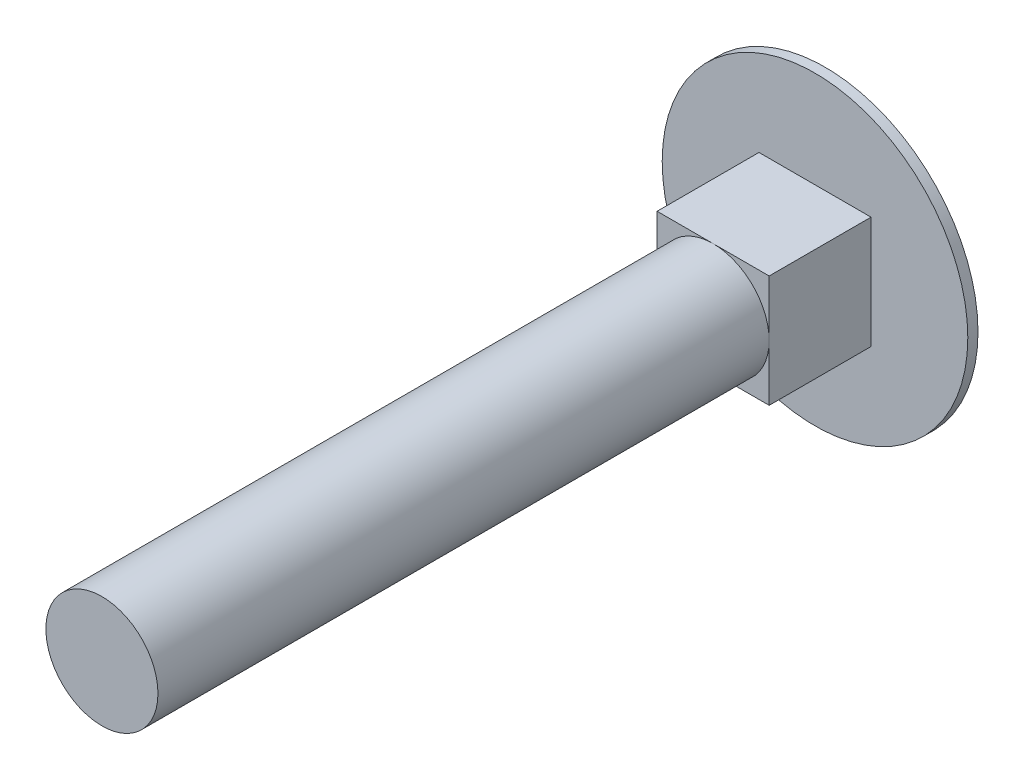
from build123d import *

# Parameters (mm, degrees)
ESQUISSE1_R        = 2.75
BOSS_EXTRU_1_DEPTH = 30
ESQUISSE2_W        = 5.5
ESQUISSE2_H        = 5.5
BOSS_EXTRU_2_DEPTH = 5
ESQUISSE3_R        = 7.5
BOSS_EXTRU_3_DEPTH = 0.5
D_ME1_FACE_RADIUS  = 7.5
D_ME1_HEIGHT       = 2.5


with BuildPart() as part:
    # Esquisse1 → Boss.-Extru.1 (new body)
    with BuildSketch(Plane.XY):
        Circle(ESQUISSE1_R)
    extrude(amount=BOSS_EXTRU_1_DEPTH)

    # Esquisse2 → Boss.-Extru.2 (add)
    with BuildSketch(Plane(origin=(0, 0, 0), x_dir=(-1, 0, 0), z_dir=(0, 0, -1))):
        Rectangle(ESQUISSE2_W, ESQUISSE2_H)
    extrude(amount=BOSS_EXTRU_2_DEPTH)

    # Esquisse3 → Boss.-Extru.3 (add)
    with BuildSketch(Plane(origin=(0, 0, -5), x_dir=(-1, 0, 0), z_dir=(0, 0, -1))):
        Circle(ESQUISSE3_R)
    extrude(amount=BOSS_EXTRU_3_DEPTH)

    # Dôme1: a dome of height H over a round flat face of radius A is a cap of a sphere of radius (A * A + H * H) / (2 * H)
    d_me1_r = (D_ME1_FACE_RADIUS * D_ME1_FACE_RADIUS + D_ME1_HEIGHT * D_ME1_HEIGHT) / (2 * D_ME1_HEIGHT)
    d_me1_base = Plane((0, 0, -5.5), z_dir=(0, 0, -1))
    with Locations(d_me1_base.offset(D_ME1_HEIGHT - d_me1_r)):
        d_me1_ball = Sphere(d_me1_r, mode=Mode.PRIVATE)
    add(split(d_me1_ball, bisect_by=d_me1_base, keep=Keep.TOP, mode=Mode.PRIVATE))


solid = part.part
